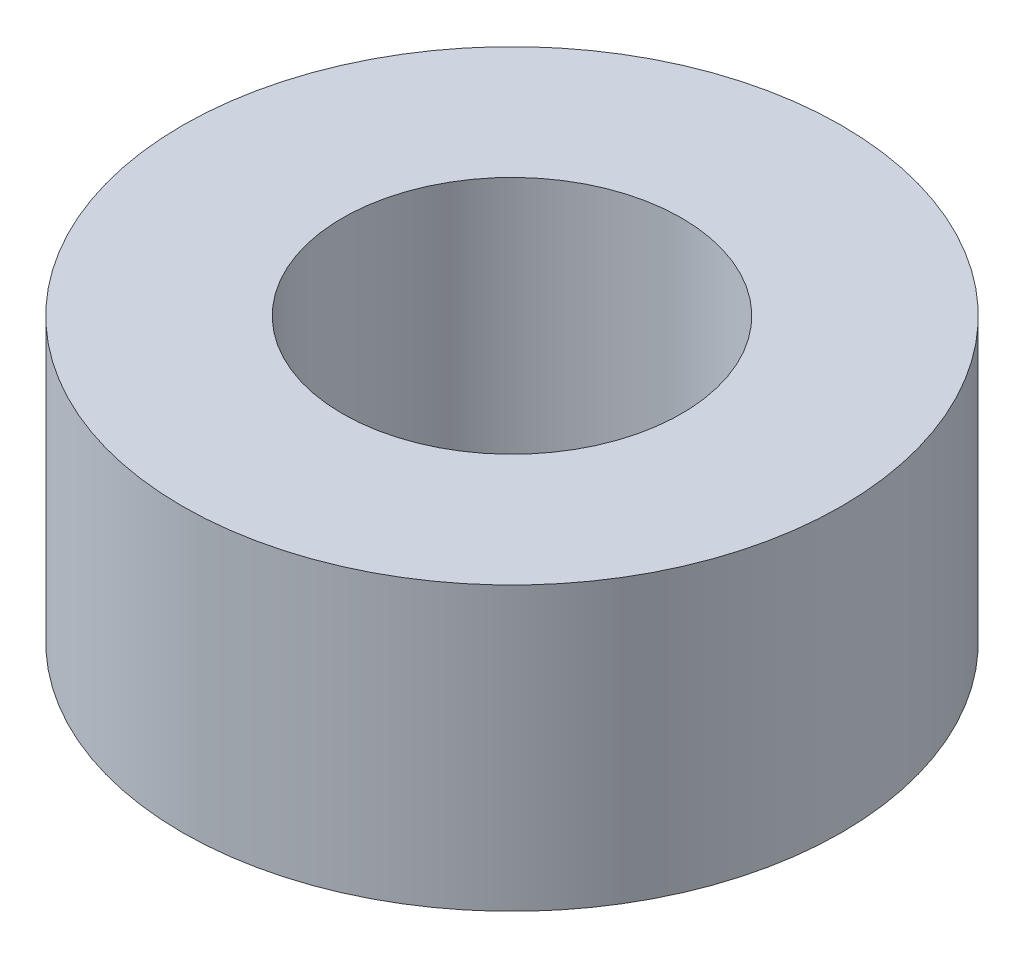
from build123d import *

# Parameters (mm, degrees)
SKETCH1_R           = 3.5
SKETCH1_R_2         = 1.8
BOSS_EXTRUDE1_DEPTH = 3


with BuildPart() as part:
    # Sketch1 → Boss-Extrude1 (new body)
    with BuildSketch(Plane(origin=(0, 0, 0), x_dir=(1, 0, 0), z_dir=(0, 1, 0))):
        with Locations(Location((0, 0, 0), (0, 0, 270))):
            Circle(SKETCH1_R)
        with Locations(Location((0, 0, 0), (0, 0, 270))):
            Circle(SKETCH1_R_2, mode=Mode.SUBTRACT)
    extrude(amount=BOSS_EXTRUDE1_DEPTH)


solid = part.part
